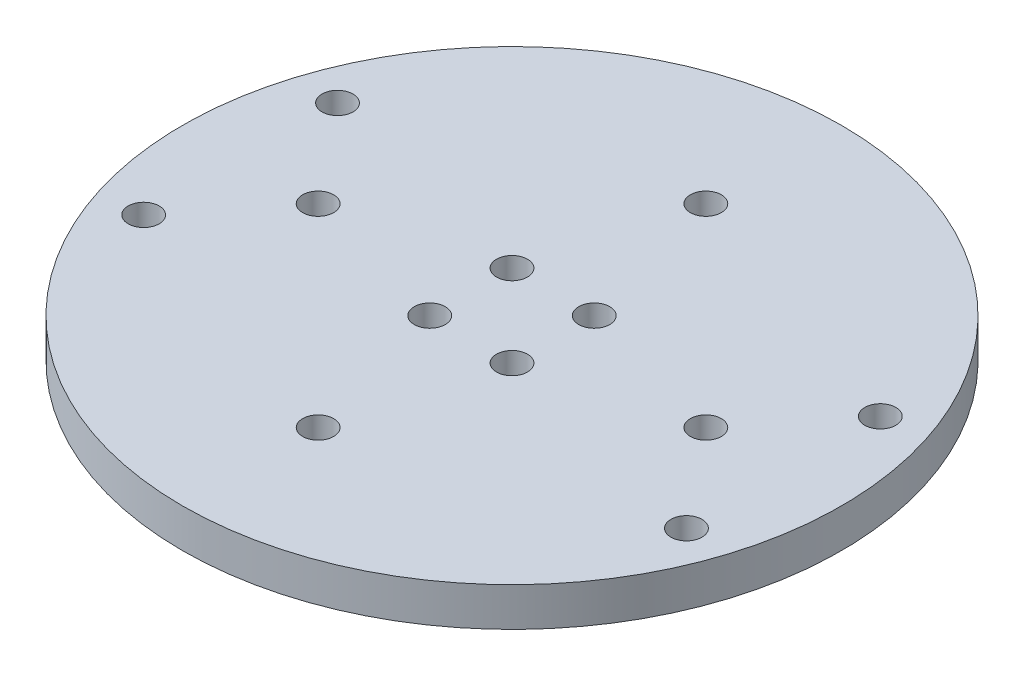
from build123d import *

# Parameters (mm, degrees)
SKETCH_1_R      = 42.5
SKETCH_1_R_2    = 2
EXTRUDE_1_DEPTH = 5


with BuildPart() as part:
    # ｽｹｯﾁ1 → ﾎﾞｽ - 押し出し1 (new body)
    with BuildSketch(Plane(origin=(0, 0, 0), x_dir=(1, 0, 0), z_dir=(0, 1, 0))):
        with Locations(Location((0, 0, 0), (0, 0, 270))):
            Circle(SKETCH_1_R)
        with Locations(Location((5.303300859, 5.303300859, 0), (0, 0, 270))):
            Circle(SKETCH_1_R_2, mode=Mode.SUBTRACT)
        with Locations(Location((5.303300859, -5.303300859, 0), (0, 0, 270))):
            Circle(SKETCH_1_R_2, mode=Mode.SUBTRACT)
        with Locations(Location((-5.303300859, -5.303300859, 0), (0, 0, 270))):
            Circle(SKETCH_1_R_2, mode=Mode.SUBTRACT)
        with Locations(Location((-5.303300859, 5.303300859, 0), (0, 0, 270))):
            Circle(SKETCH_1_R_2, mode=Mode.SUBTRACT)
        with Locations(Location((25, 0, 0), (0, 0, 270))):
            Circle(SKETCH_1_R_2, mode=Mode.SUBTRACT)
        with Locations(Location((0, -25, 0), (0, 0, 270))):
            Circle(SKETCH_1_R_2, mode=Mode.SUBTRACT)
        with Locations(Location((-25, 0, 0), (0, 0, 270))):
            Circle(SKETCH_1_R_2, mode=Mode.SUBTRACT)
        with Locations(Location((0, 25, 0), (0, 0, 270))):
            Circle(SKETCH_1_R_2, mode=Mode.SUBTRACT)
        with Locations(Location((35, 12.5, 0), (0, 0, 270))):
            Circle(SKETCH_1_R_2, mode=Mode.SUBTRACT)
        with Locations(Location((35, -12.5, 0), (0, 0, 270))):
            Circle(SKETCH_1_R_2, mode=Mode.SUBTRACT)
        with Locations(Location((-35, -12.5, 0), (0, 0, 270))):
            Circle(SKETCH_1_R_2, mode=Mode.SUBTRACT)
        with Locations(Location((-35, 12.5, 0), (0, 0, 270))):
            Circle(SKETCH_1_R_2, mode=Mode.SUBTRACT)
    extrude(amount=EXTRUDE_1_DEPTH)


solid = part.part
